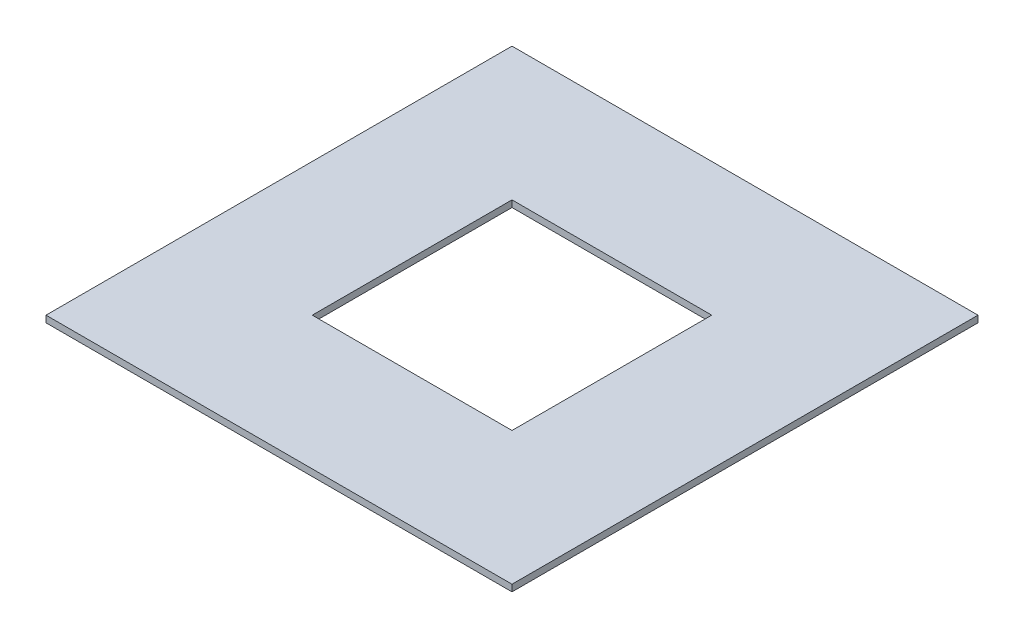
from build123d import *

# Parameters (mm, degrees)
SKETCH4_W           = 177.8
SKETCH4_H           = 177.8
BOSS_EXTRUDE2_DEPTH = 2.54
SKETCH5_W           = 76.2
SKETCH5_H           = 76.2
CUT_EXTRUDE1_DEPTH  = 84.074


with BuildPart() as part:
    # Sketch4 → Boss-Extrude2 (new body)
    with BuildSketch(Plane(origin=(0, 0, 0), x_dir=(1, 0, 0), z_dir=(0, 1, 0))):
        with Locations((-11.748126233, 27.003155819)):
            Rectangle(SKETCH4_W, SKETCH4_H)
    extrude(amount=-BOSS_EXTRUDE2_DEPTH)

    # Sketch5 → Cut-Extrude1 (cut)
    with BuildSketch(Plane(origin=(0, 0, 0), x_dir=(1, 0, 0), z_dir=(0, 1, 0))):
        with Locations((-11.748126233, 27.003155819)):
            Rectangle(SKETCH5_W, SKETCH5_H)
    extrude(amount=-CUT_EXTRUDE1_DEPTH, mode=Mode.SUBTRACT)


solid = part.part
